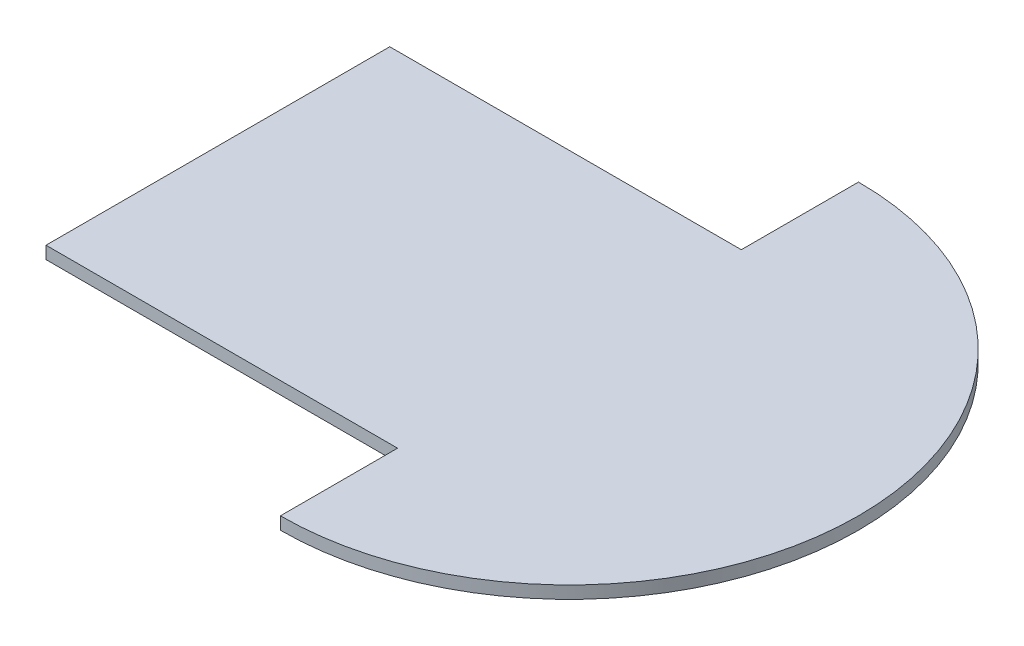
from build123d import *

# Parameters (mm, degrees)
BOSS_EXTRUDE1_DEPTH = 1.6


with BuildPart() as part:
    # Sketch1 → Boss-Extrude1 (new body)
    with BuildSketch(Plane(origin=(0, 0, 0), x_dir=(1, 0, 0), z_dir=(0, 1, 0))):
        with BuildLine():
            Line((-81.718696665, 33.036003586), (-81.718696665, -10.963996414))
            Line((-81.718696665, -10.963996414), (-36.718696665, -10.963996414))
            Line((-36.718696665, -10.963996414), (-36.718696665, -25.963996414))
            ThreePointArc((-36.718696665, -25.963996414), (0.281303335, 11.036003586), (-36.718696665, 48.036003586))
            Line((-36.718696665, 48.036003586), (-36.718696665, 33.036003586))
            Line((-36.718696665, 33.036003586), (-81.718696665, 33.036003586))
        make_face()
    extrude(amount=BOSS_EXTRUDE1_DEPTH)


solid = part.part
